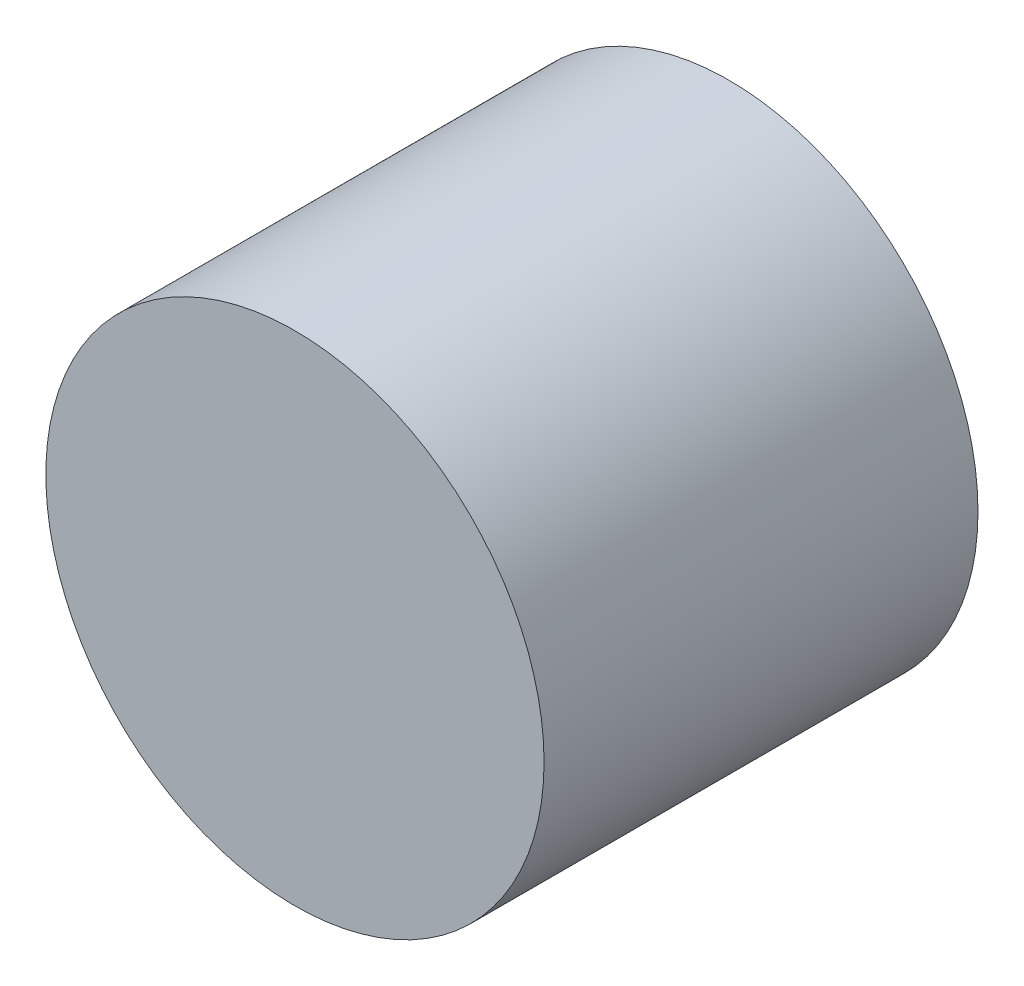
from build123d import *

# Parameters (mm, degrees)
SCHIZZO1_R                   = 3.875
ESTRUSIONE_ESTRUSIONE1_DEPTH = 6.75


with BuildPart() as part:
    # Schizzo1 → Estrusione-Estrusione1 (new body)
    with BuildSketch(Plane.XY):
        Circle(SCHIZZO1_R)
    extrude(amount=ESTRUSIONE_ESTRUSIONE1_DEPTH)


solid = part.part
